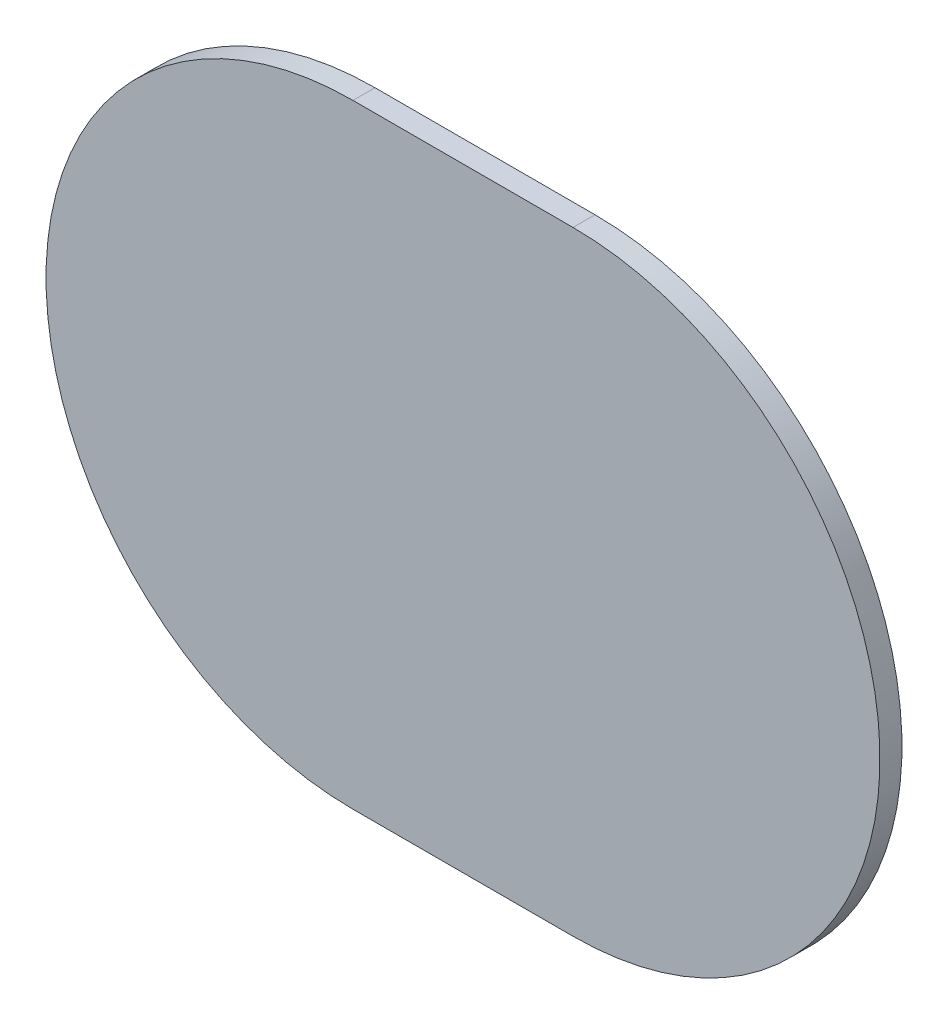
from build123d import *

# Parameters (mm, degrees)
EXTRUDE_1_DEPTH = 2


with BuildPart() as part:
    # 草图1 → 凸台-拉伸1 (new body)
    with BuildSketch(Plane.XY):
        with BuildLine():
            Line((-10, -27.9), (10, -27.9))
            ThreePointArc((10, -27.9), (37.9, 0), (10, 27.9))
            Line((10, 27.9), (-10, 27.9))
            ThreePointArc((-10, 27.9), (-37.9, 0), (-10, -27.9))
        make_face()
    extrude(amount=EXTRUDE_1_DEPTH)


solid = part.part
